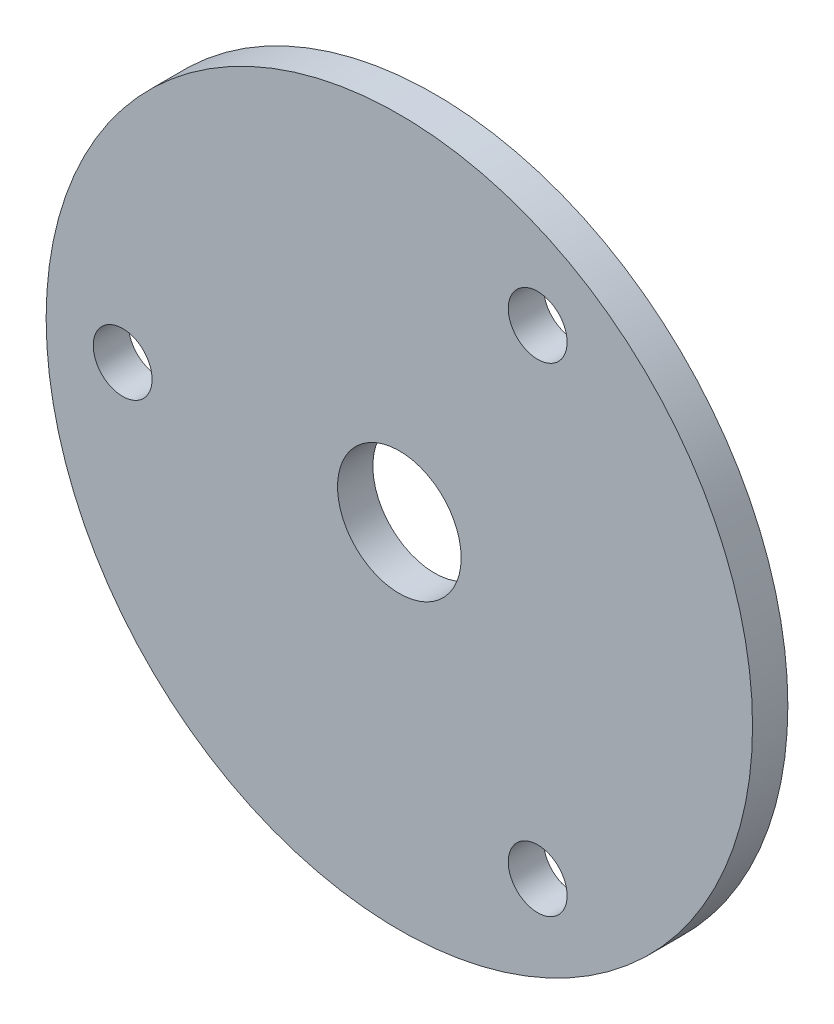
from build123d import *

# Parameters (mm, degrees)
SKETCH_1_R      = 30
SKETCH_1_R_2    = 2.5
SKETCH_1_R_3    = 5.25
EXTRUDE_1_DEPTH = 3


with BuildPart() as part:
    # ｽｹｯﾁ1 → ﾎﾞｽ - 押し出し1 (new body)
    with BuildSketch(Plane.XY):
        Circle(SKETCH_1_R)
        with Locations((-23.5, 0)):
            Circle(SKETCH_1_R_2, mode=Mode.SUBTRACT)
        with Locations((11.75, -20.351596989)):
            Circle(SKETCH_1_R_2, mode=Mode.SUBTRACT)
        with Locations((11.75, 20.351596989)):
            Circle(SKETCH_1_R_2, mode=Mode.SUBTRACT)
        Circle(SKETCH_1_R_3, mode=Mode.SUBTRACT)
    extrude(amount=EXTRUDE_1_DEPTH)


solid = part.part
